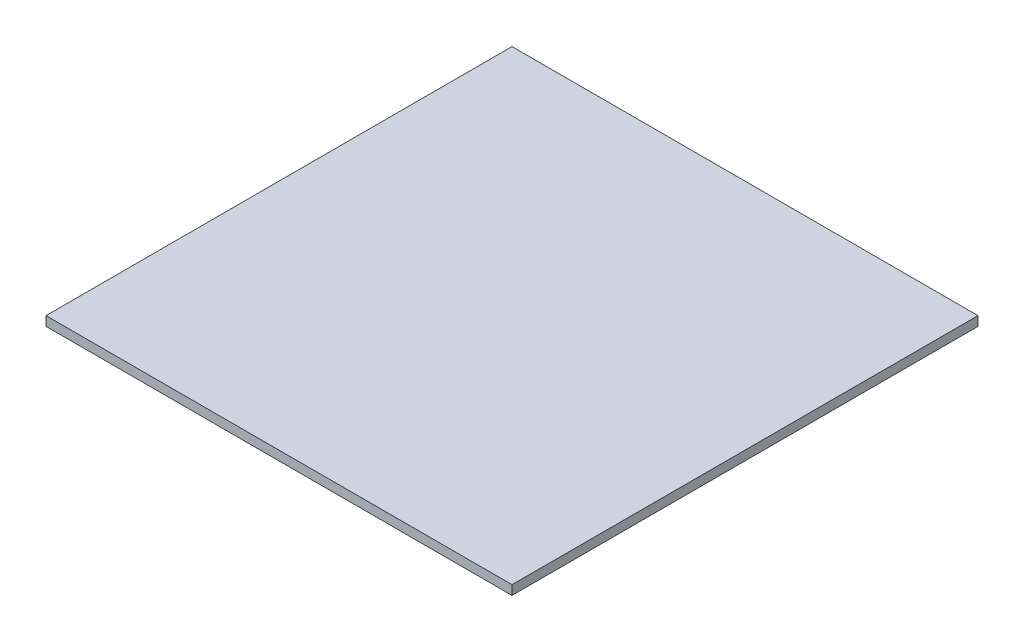
from build123d import *

# Parameters (mm, degrees)
CROQUIS1_W              = 500
CROQUIS1_H              = 500
SALIENTE_EXTRUIR1_DEPTH = 10


with BuildPart() as part:
    # Croquis1 → Saliente-Extruir1 (new body)
    with BuildSketch(Plane(origin=(0, 0, 0), x_dir=(1, 0, 0), z_dir=(0, 1, 0))):
        with Locations((0, -250)):
            Rectangle(CROQUIS1_W, CROQUIS1_H)
    extrude(amount=SALIENTE_EXTRUIR1_DEPTH)


solid = part.part
